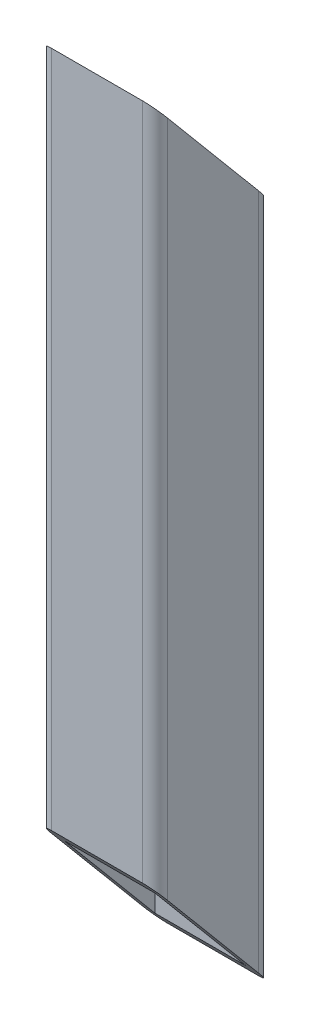
from build123d import *

# Parameters (mm, degrees)
BOSS_EXTRUDE1_DEPTH     = 180
SKETCH3_W               = 20
SKETCH3_H               = 20
CUT_EXTRUDE1_DEPTH      = 1040.5
CUT_EXTRUDE5_DEPTH      = 184.604792966
CUT_EXTRUDE5_DEPTH_BACK = 184.604792966
CUT_EXTRUDE6_DEPTH      = 184.604792966
CUT_EXTRUDE6_DEPTH_BACK = 184.604792966


with BuildPart() as part:
    # Sketch1 → Boss-Extrude1 (new body)
    with BuildSketch(Plane(origin=(0, 0, 0), x_dir=(1, 0, 0), z_dir=(0, 1, 0))):
        with BuildLine():
            Line((2.8, 0), (22.8, 0))
            ThreePointArc((22.8, 0), (24.779898987, -0.820101013), (25.6, -2.8))
            Line((25.6, -2.8), (25.6, -22.8))
            ThreePointArc((25.6, -22.8), (24.779898987, -24.779898987), (22.8, -25.6))
            Line((22.8, -25.6), (2.8, -25.6))
            ThreePointArc((2.8, -25.6), (0.820101013, -24.779898987), (0, -22.8))
            Line((0, -22.8), (0, -2.8))
            ThreePointArc((0, -2.8), (0.820101013, -0.820101013), (2.8, 0))
        make_face()
    extrude(amount=BOSS_EXTRUDE1_DEPTH)

    # Sketch3 → Cut-Extrude1 (cut)
    with BuildSketch(Plane(origin=(0, 0, 0), x_dir=(-1, 0, 0), z_dir=(0, -1, 0))):
        with Locations((-12.8, -12.8)):
            Rectangle(SKETCH3_W, SKETCH3_H)
    extrude(amount=-CUT_EXTRUDE1_DEPTH, mode=Mode.SUBTRACT)

    # Sketch4 → Cut-Extrude5 (cut, two sides: drawn at the far end of the back side and taken through both)
    with BuildSketch(Plane(origin=(0, 0, 0), x_dir=(0, 0, -1), z_dir=(1, 0, 0)).offset(-CUT_EXTRUDE5_DEPTH_BACK)):
        Polygon((240.160017549, -286.211563711), (0, 0), (-37.642040262, 44.860036715), (-277.802057811, 331.071600426), (-850.225185234, -149.248434672), (-332.263109874, -766.531598809), align=None)
    extrude(amount=CUT_EXTRUDE5_DEPTH + CUT_EXTRUDE5_DEPTH_BACK, mode=Mode.SUBTRACT)

    # Sketch5 → Cut-Extrude6 (cut, two sides: drawn at the far end of the back side and taken through both)
    with BuildSketch(Plane(origin=(0, 0, 0), x_dir=(0, 0, -1), z_dir=(1, 0, 0)).offset(-CUT_EXTRUDE6_DEPTH_BACK)):
        Polygon((-265.701334921, 466.260794033), (-25.6, 180), (12.011413449, 135.157795845), (252.11274837, -151.102998188), (824.634336435, 329.099671655), (306.820253144, 946.463463875), align=None)
    extrude(amount=CUT_EXTRUDE6_DEPTH + CUT_EXTRUDE6_DEPTH_BACK, mode=Mode.SUBTRACT)


solid = part.part
